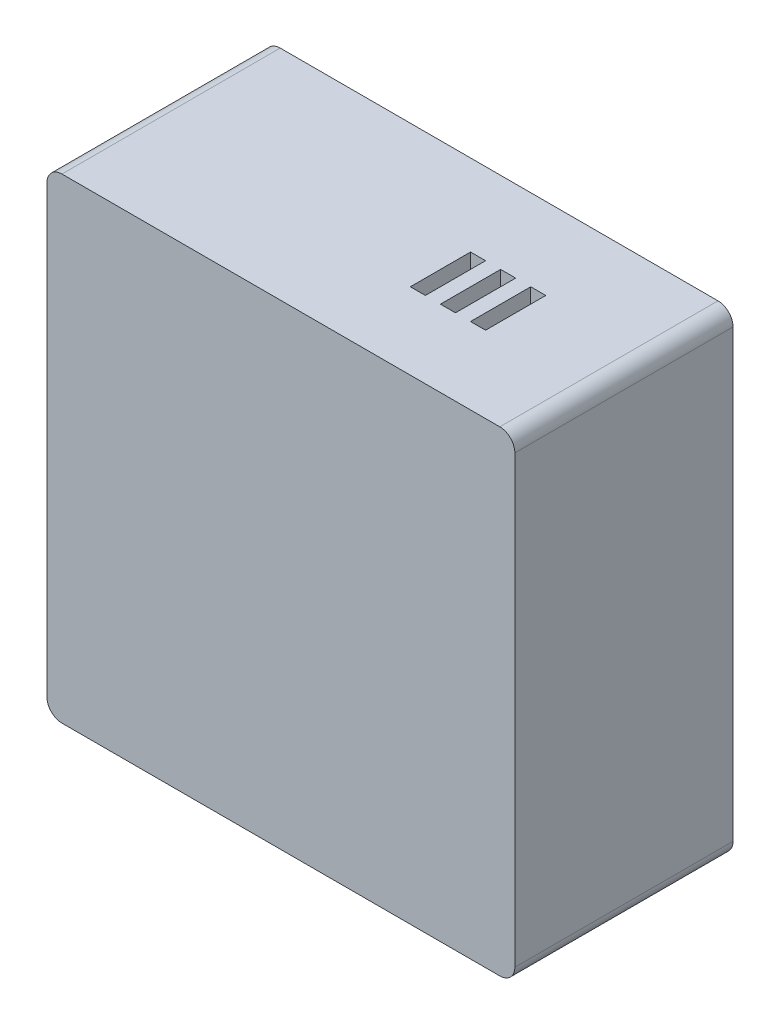
from build123d import *

# Parameters (mm, degrees)
SKETCH_2_W          = 31.092354585
SKETCH_2_H          = 31.600355601
EXTRUDE_1_DEPTH     = 1.5
SKETCH_3_R          = 1.9
SKETCH_3_R_2        = 0.85
EXTRUDE_2_DEPTH     = 2
SKETCH_4_W          = 31.092354585
SKETCH_4_H          = 31.600355601
SKETCH_4_R          = 0.9
SKETCH_4_R_2        = 0.95
EXTRUDE_3_DEPTH     = 13
CUT_EXTRUDE_1_REACH = 46.929
SKETCH_5_R          = 0.5
SKETCH_5_W          = 3.540807658
SKETCH_5_H          = 9.178364527
CUT_EXTRUDE_2_REACH = 46.95
SKETCH_6_W          = 4.41346869
SKETCH_6_H          = 8.209522231
CUT_EXTRUDE_3_REACH = 46.95
SKETCH_8_W          = 1
SKETCH_8_H          = 4
FILLET_1_R          = 1
FILLET_2_R          = 0.8


with BuildPart() as part:
    # 草图2 → 凸台-拉伸1 (new body)
    with BuildSketch(Plane.XY):
        with Locations((-13.658877318, -13.912877826)):
            Rectangle(SKETCH_2_W, SKETCH_2_H)
    extrude(amount=EXTRUDE_1_DEPTH)

    # 草图3 → 凸台-拉伸2 (add)
    # profile 1 of 2: a face of its own
    with BuildSketch(Plane(origin=(0, 0, 0), x_dir=(-1, 0, 0), z_dir=(0, 0, -1))):
        with Locations(Location((20.20004064, -2.16000508, 0), (0, 0, 180))):
            Circle(SKETCH_3_R)
        with Locations(Location((20.20004064, -2.16000508, 0), (0, 0, 180))):
            Circle(SKETCH_3_R_2, mode=Mode.SUBTRACT)
    # profile 2 of 2: a face of its own
    with BuildSketch(Plane(origin=(0, 0, 0), x_dir=(-1, 0, 0), z_dir=(0, 0, -1))):
        with Locations(Location((7.24001524, -25.6500508, 0), (0, 0, 180))):
            Circle(SKETCH_3_R)
        with Locations(Location((7.24001524, -25.6500508, 0), (0, 0, 180))):
            Circle(SKETCH_3_R_2, mode=Mode.SUBTRACT)
    extrude(amount=EXTRUDE_2_DEPTH)

    # 草图4 → 凸台-拉伸3 (add)
    # profile 1 of 2: a face of its own
    with BuildSketch(Plane(origin=(0, 0, 0), x_dir=(-1, 0, 0), z_dir=(0, 0, -1))):
        with Locations((13.658877318, -13.912877826)):
            Rectangle(SKETCH_4_W, SKETCH_4_H)
        Polygon((-0.387299975, -28.213055626), (-0.387299975, -23.216633759), (-0.387299975, 0.387299975), (22.708632743, 0.387299975), (27.70505461, 0.387299975), (27.70505461, -28.213055626), align=None, mode=Mode.SUBTRACT)
    # profile 2 of 2: a face of its own
    with BuildSketch(Plane(origin=(0, 0, 0), x_dir=(-1, 0, 0), z_dir=(0, 0, -1))):
        with BuildLine():
            Line((22.708632743, -28.200355601), (4.596421868, -28.200355601))
            ThreePointArc((4.596421868, -28.200355601), (3.261678652, -24.551376974), (-0.387299975, -23.216633759))
            Line((-0.387299975, -23.216633759), (-0.387299975, -28.213055626))
            Line((-0.387299975, -28.213055626), (27.70505461, -28.213055626))
            Line((27.70505461, -28.213055626), (27.70505461, 0.387299975))
            Line((27.70505461, 0.387299975), (22.708632743, 0.387299975))
            ThreePointArc((22.708632743, 0.387299975), (24.043375958, -3.261678652), (27.692354585, -4.596421868))
            Line((27.692354585, -4.596421868), (27.692354585, -23.216633759))
            ThreePointArc((27.692354585, -23.216633759), (24.043375958, -24.551376974), (22.708632743, -28.200355601))
        make_face()
        with Locations(Location((2.008877318, -25.812877826, 0), (0, 0, 180))):
            Circle(SKETCH_4_R, mode=Mode.SUBTRACT)
        with Locations(Location((25.308877318, -25.812877826, 0), (0, 0, 180))):
            Circle(SKETCH_4_R, mode=Mode.SUBTRACT)
        with Locations(Location((25.308877318, -2.012877826, 0), (0, 0, 180))):
            Circle(SKETCH_4_R_2, mode=Mode.SUBTRACT)
    extrude(amount=EXTRUDE_3_DEPTH)

    # 草图5 → 切除-拉伸1 (cut, up to next)
    with BuildSketch(Plane.ZY.offset(29.20505461), mode=Mode.PRIVATE) as cut_extrude_1_sk1:
        with Locations((-5.206157057, -6.409348234)):
            Circle(SKETCH_5_R)
    cut_extrude_1_tool1 = extrude(cut_extrude_1_sk1.sketch, amount=-CUT_EXTRUDE_1_REACH, mode=Mode.PRIVATE) & part.part
    # 草图5 → 切除-拉伸1 (cut, up to next)
    with BuildSketch(Plane.ZY.offset(29.20505461), mode=Mode.PRIVATE) as cut_extrude_1_sk2:
        with Locations((-5.206157057, -13.961165862)):
            Rectangle(SKETCH_5_W, SKETCH_5_H)
    cut_extrude_1_tool2 = extrude(cut_extrude_1_sk2.sketch, amount=-CUT_EXTRUDE_1_REACH, mode=Mode.PRIVATE) & part.part
    add(cut_extrude_1_tool1.solids().sort_by_distance((-29.205055, -6.409348, -5.206157))[0], mode=Mode.SUBTRACT)
    add(cut_extrude_1_tool2.solids().sort_by_distance((-29.205055, -13.961166, -5.206157))[0], mode=Mode.SUBTRACT)

    # 草图6 → 切除-拉伸2 (cut, up to next)
    with BuildSketch(Plane.XZ.offset(29.713055626), mode=Mode.PRIVATE) as cut_extrude_2_sk1:
        with Locations((-14.717018129, -8.895238884)):
            Rectangle(SKETCH_6_W, SKETCH_6_H)
    cut_extrude_2_tool1 = extrude(cut_extrude_2_sk1.sketch, amount=-CUT_EXTRUDE_2_REACH, mode=Mode.PRIVATE) & part.part
    add(cut_extrude_2_tool1.solids().sort_by_distance((-14.717018, -29.713056, -8.895239))[0], mode=Mode.SUBTRACT)

    # 草图8 → 切除-拉伸3 (cut, up to next)
    with BuildSketch(Plane(origin=(0, 1.887299975, 0), x_dir=(1, 0, 0), z_dir=(0, 1, 0)), mode=Mode.PRIVATE) as cut_extrude_3_sk1:
        with Locations((-7.644018288, 5.586156972)):
            Rectangle(SKETCH_8_W, SKETCH_8_H)
    cut_extrude_3_tool1 = extrude(cut_extrude_3_sk1.sketch, amount=-CUT_EXTRUDE_3_REACH, mode=Mode.PRIVATE) & part.part
    # 草图8 → 切除-拉伸3 (cut, up to next)
    with BuildSketch(Plane(origin=(0, 1.887299975, 0), x_dir=(1, 0, 0), z_dir=(0, 1, 0)), mode=Mode.PRIVATE) as cut_extrude_3_sk2:
        with Locations((-9.644018288, 5.586156972)):
            Rectangle(SKETCH_8_W, SKETCH_8_H)
    cut_extrude_3_tool2 = extrude(cut_extrude_3_sk2.sketch, amount=-CUT_EXTRUDE_3_REACH, mode=Mode.PRIVATE) & part.part
    # 草图8 → 切除-拉伸3 (cut, up to next)
    with BuildSketch(Plane(origin=(0, 1.887299975, 0), x_dir=(1, 0, 0), z_dir=(0, 1, 0)), mode=Mode.PRIVATE) as cut_extrude_3_sk3:
        with Locations((-5.644018288, 5.586156972)):
            Rectangle(SKETCH_8_W, SKETCH_8_H)
    cut_extrude_3_tool3 = extrude(cut_extrude_3_sk3.sketch, amount=-CUT_EXTRUDE_3_REACH, mode=Mode.PRIVATE) & part.part
    add(cut_extrude_3_tool1.solids().sort_by_distance((-7.644018, 1.8873, -5.586157))[0], mode=Mode.SUBTRACT)
    add(cut_extrude_3_tool2.solids().sort_by_distance((-9.644018, 1.8873, -5.586157))[0], mode=Mode.SUBTRACT)
    add(cut_extrude_3_tool3.solids().sort_by_distance((-5.644018, 1.8873, -5.586157))[0], mode=Mode.SUBTRACT)

    # 圆角1
    fillet_1_edges = [part.edges().sort_by_distance(p)[0] for p in [
        (-29.20505461, 1.887299975, -5.75),
        (1.887299975, 1.887299975, -5.75),
        (1.887299975, -29.713055626, -5.75),
        (-29.20505461, -29.713055626, -5.75),
    ]]
    fillet(fillet_1_edges, radius=FILLET_1_R)

    # 圆角2
    fillet_2_edges = [part.edges().sort_by_distance(p)[0] for p in [
        (-28.448704597, -9.371983599, -6.976560886),
        (-28.448704597, -9.371983599, -3.435753228),
        (-28.448704597, -18.550348126, -3.435753228),
        (-28.448704597, -18.550348126, -6.976560886),
    ]]
    fillet(fillet_2_edges, radius=FILLET_2_R)


solid = part.part
